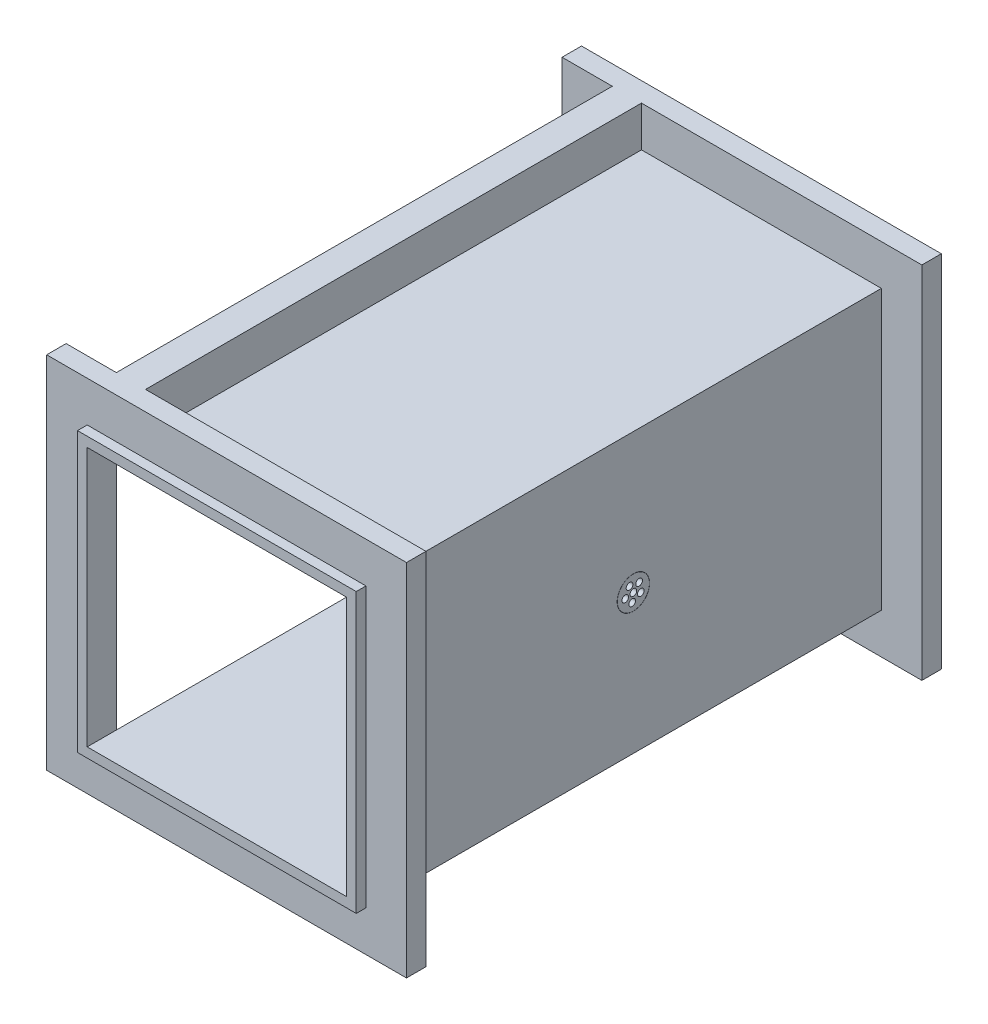
from build123d import *

# Parameters (mm, degrees)
SKETCH1_W           = 172
SKETCH1_H           = 172
SKETCH1_W_2         = 160
SKETCH1_H_2         = 160
EXTRUDE_THIN1_DEPTH = 330
SKETCH5_W           = 222
SKETCH5_H           = 222
SKETCH5_W_2         = 160
SKETCH5_H_2         = 160
BOSS_EXTRUDE2_DEPTH = 12
SKETCH6_W           = 172
SKETCH6_H           = 172
SKETCH6_W_2         = 160
SKETCH6_H_2         = 160
EXTRUDE_THIN2_DEPTH = 6
SKETCH7_W           = 6
SKETCH7_H           = 306
CUT_EXTRUDE1_DEPTH  = 406.001234566
SKETCH8_W           = 18
SKETCH8_H           = 306
BOSS_EXTRUDE3_DEPTH = 25
SKETCH10_R          = 10
SKETCH10_R_2        = 9.9
SKETCH10_R_3        = 2.05
CUT_EXTRUDE2_DEPTH  = 406.001234566
SKETCH11_R          = 10
SKETCH11_R_2        = 3
SKETCH11_W          = 12
SKETCH11_H          = 40
CUT_EXTRUDE3_DEPTH  = 79


with BuildPart() as part:
    # Sketch1 → Extrude-Thin1 (new body)
    with BuildSketch(Plane.XY):
        Rectangle(SKETCH1_W, SKETCH1_H)
        Rectangle(SKETCH1_W_2, SKETCH1_H_2, mode=Mode.SUBTRACT)
    extrude(amount=EXTRUDE_THIN1_DEPTH)

    # Sketch5 → Boss-Extrude2 (add)
    with BuildSketch(Plane.XY.offset(330)):
        Rectangle(SKETCH5_W, SKETCH5_H)
        Rectangle(SKETCH5_W_2, SKETCH5_H_2, mode=Mode.SUBTRACT)
    boss_extrude2 = extrude(amount=-BOSS_EXTRUDE2_DEPTH)

    # Mirror2: Boss-Extrude2 across plane
    add(boss_extrude2.mirror(Plane.XY.offset(165)))

    # Sketch6 → Extrude-Thin2 (add)
    with BuildSketch(Plane(origin=(0, 0, 0), x_dir=(-1, 0, 0), z_dir=(0, 0, -1))):
        Rectangle(SKETCH6_W, SKETCH6_H)
        Rectangle(SKETCH6_W_2, SKETCH6_H_2, mode=Mode.SUBTRACT)
    extrude_thin2 = extrude(amount=EXTRUDE_THIN2_DEPTH)

    # Mirror3: Extrude-Thin2 across plane
    add(extrude_thin2.mirror(Plane.XY.offset(165)))

    # Sketch7 → Cut-Extrude1 (cut, through all)
    with BuildSketch(Plane(origin=(0, 86, 0), x_dir=(1, 0, 0), z_dir=(0, 1, 0))):
        with Locations((-83, -165)):
            Rectangle(SKETCH7_W, SKETCH7_H)
    extrude(amount=-CUT_EXTRUDE1_DEPTH, mode=Mode.SUBTRACT)

    # Sketch8 → Boss-Extrude3 (add)
    with BuildSketch(Plane(origin=(0, 86, 0), x_dir=(1, 0, 0), z_dir=(0, 1, 0))):
        with Locations((-71, -165)):
            Rectangle(SKETCH8_W, SKETCH8_H)
    boss_extrude3 = extrude(amount=BOSS_EXTRUDE3_DEPTH)

    # Mirror7: Boss-Extrude3 across plane
    add(boss_extrude3.mirror(Plane.ZX))

    # Sketch10 → Cut-Extrude2 (cut, through all)
    # profile 1 of 7: a face of its own
    with BuildSketch(Plane(origin=(86, 0, 0), x_dir=(0, 0, -1), z_dir=(1, 0, 0))):
        with Locations((-165, 0)):
            Circle(SKETCH10_R)
        with Locations((-165, 0)):
            Circle(SKETCH10_R_2, mode=Mode.SUBTRACT)
    # profile 2 of 7: a face of its own
    with BuildSketch(Plane(origin=(86, 0, 0), x_dir=(0, 0, -1), z_dir=(1, 0, 0))):
        with Locations((-160.421523837, -2.246676661)):
            Circle(SKETCH10_R_3)
    # profile 3 of 7: a face of its own
    with BuildSketch(Plane(origin=(86, 0, 0), x_dir=(0, 0, -1), z_dir=(1, 0, 0))):
        with Locations((-165.721889536, -5.048650859)):
            Circle(SKETCH10_R_3)
    # profile 4 of 7: a face of its own
    with BuildSketch(Plane(origin=(86, 0, 0), x_dir=(0, 0, -1), z_dir=(1, 0, 0))):
        with Locations((-170.024628433, -0.873561167)):
            Circle(SKETCH10_R_3)
    # profile 5 of 7: a face of its own
    with BuildSketch(Plane(origin=(86, 0, 0), x_dir=(0, 0, -1), z_dir=(1, 0, 0))):
        with Locations((-165, 0)):
            Circle(SKETCH10_R_3)
    # profile 6 of 7: a face of its own
    with BuildSketch(Plane(origin=(86, 0, 0), x_dir=(0, 0, -1), z_dir=(1, 0, 0))):
        with Locations((-161.448456578, 3.660128321)):
            Circle(SKETCH10_R_3)
    # profile 7 of 7: a face of its own
    with BuildSketch(Plane(origin=(86, 0, 0), x_dir=(0, 0, -1), z_dir=(1, 0, 0))):
        with Locations((-167.383501616, 4.508760367)):
            Circle(SKETCH10_R_3)
    extrude(amount=-CUT_EXTRUDE2_DEPTH, mode=Mode.SUBTRACT)


with BuildPart() as cut_extrude2_piece_1:
    # of the separate pieces the step leaves, piece 1, a body of its own (cut_extrude2_pieces)
    add(part.part.solids().sort_by_distance((111, -111, 0))[0])

    # Sketch11 → Cut-Extrude3 (cut)
    with BuildSketch(Plane(origin=(0, -80, 0), x_dir=(1, 0, 0), z_dir=(0, 1, 0))):
        with Locations(Location((-15, -29, 0), (0, 0, 180))):
            Circle(SKETCH11_R)
        with Locations(Location((0, -195, 0), (0, 0, 180))):
            Circle(SKETCH11_R_2)
        with Locations(Location((15, -29, 0), (0, 0, 180))):
            Circle(SKETCH11_R)
        with Locations((0, -165)):
            Rectangle(SKETCH11_W, SKETCH11_H)
    extrude(amount=-CUT_EXTRUDE3_DEPTH, mode=Mode.SUBTRACT)


with BuildPart() as cut_extrude2_piece_2:
    # of the separate pieces the step leaves, piece 2, a body of its own (cut_extrude2_pieces)
    add(part.part.solids().sort_by_distance((86, 0, 155.1))[0])


solid = Compound([cut_extrude2_piece_1.part, cut_extrude2_piece_2.part])
